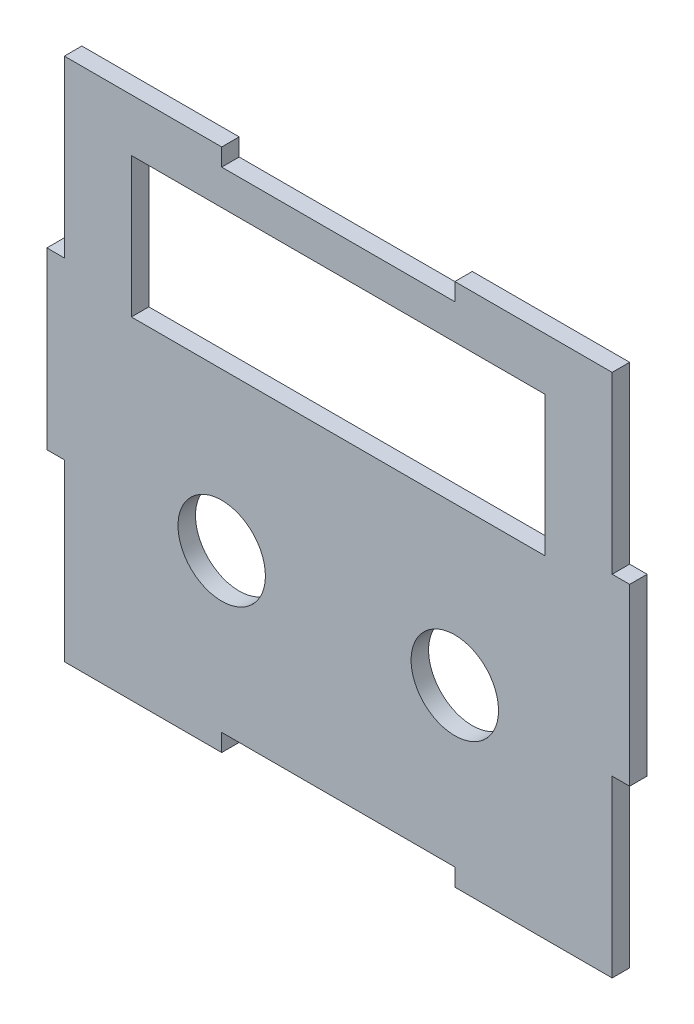
from build123d import *

# Parameters (mm, degrees)
ESQUISSE1_W             = 100
ESQUISSE1_H             = 90
ESQUISSE1_R             = 7.5
ESQUISSE1_W_2           = 71
ESQUISSE1_H_2           = 24
BOSS_EXTRU_1_DEPTH      = 3
ENL_V_MAT_EXTRU_1_REACH = 90.04
ESQUISSE2_W             = 40
ESQUISSE2_H             = 3
ESQUISSE2_W_2           = 3
ESQUISSE2_H_2           = 30


with BuildPart() as part:
    # Esquisse1 → Boss.-Extru.1 (new body)
    with BuildSketch(Plane.XY):
        with Locations((-10.038524431, -19.32304038)):
            Rectangle(ESQUISSE1_W, ESQUISSE1_H)
        with Locations((-30.038524431, -34.32304038)):
            Circle(ESQUISSE1_R, mode=Mode.SUBTRACT)
        with Locations((9.961475569, -34.32304038)):
            Circle(ESQUISSE1_R, mode=Mode.SUBTRACT)
        with Locations((-10.038524431, 4.660332542)):
            Rectangle(ESQUISSE1_W_2, ESQUISSE1_H_2, mode=Mode.SUBTRACT)
    extrude(amount=BOSS_EXTRU_1_DEPTH)

    # Esquisse2 → Enlèv. mat.-Extru.1 (cut, up to next)
    with BuildSketch(Plane.XY.offset(3), mode=Mode.PRIVATE) as enl_v_mat_extru_1_sk1:
        with Locations((-10.038524431, 24.17695962)):
            Rectangle(ESQUISSE2_W, ESQUISSE2_H)
    enl_v_mat_extru_1_tool1 = extrude(enl_v_mat_extru_1_sk1.sketch, amount=-ENL_V_MAT_EXTRU_1_REACH, mode=Mode.PRIVATE) & part.part
    # Esquisse2 → Enlèv. mat.-Extru.1 (cut, up to next)
    with BuildSketch(Plane.XY.offset(3), mode=Mode.PRIVATE) as enl_v_mat_extru_1_sk2:
        with Locations((-58.538524431, 10.67695962)):
            Rectangle(ESQUISSE2_W_2, ESQUISSE2_H_2)
    enl_v_mat_extru_1_tool2 = extrude(enl_v_mat_extru_1_sk2.sketch, amount=-ENL_V_MAT_EXTRU_1_REACH, mode=Mode.PRIVATE) & part.part
    # Esquisse2 → Enlèv. mat.-Extru.1 (cut, up to next)
    with BuildSketch(Plane.XY.offset(3), mode=Mode.PRIVATE) as enl_v_mat_extru_1_sk3:
        with Locations((-58.538524431, -49.32304038)):
            Rectangle(ESQUISSE2_W_2, ESQUISSE2_H_2)
    enl_v_mat_extru_1_tool3 = extrude(enl_v_mat_extru_1_sk3.sketch, amount=-ENL_V_MAT_EXTRU_1_REACH, mode=Mode.PRIVATE) & part.part
    # Esquisse2 → Enlèv. mat.-Extru.1 (cut, up to next)
    with BuildSketch(Plane.XY.offset(3), mode=Mode.PRIVATE) as enl_v_mat_extru_1_sk4:
        with Locations((-10.038524431, -62.82304038)):
            Rectangle(ESQUISSE2_W, ESQUISSE2_H)
    enl_v_mat_extru_1_tool4 = extrude(enl_v_mat_extru_1_sk4.sketch, amount=-ENL_V_MAT_EXTRU_1_REACH, mode=Mode.PRIVATE) & part.part
    # Esquisse2 → Enlèv. mat.-Extru.1 (cut, up to next)
    with BuildSketch(Plane.XY.offset(3), mode=Mode.PRIVATE) as enl_v_mat_extru_1_sk5:
        with Locations((38.461475569, -49.32304038)):
            Rectangle(ESQUISSE2_W_2, ESQUISSE2_H_2)
    enl_v_mat_extru_1_tool5 = extrude(enl_v_mat_extru_1_sk5.sketch, amount=-ENL_V_MAT_EXTRU_1_REACH, mode=Mode.PRIVATE) & part.part
    # Esquisse2 → Enlèv. mat.-Extru.1 (cut, up to next)
    with BuildSketch(Plane.XY.offset(3), mode=Mode.PRIVATE) as enl_v_mat_extru_1_sk6:
        with Locations((38.461475569, 10.67695962)):
            Rectangle(ESQUISSE2_W_2, ESQUISSE2_H_2)
    enl_v_mat_extru_1_tool6 = extrude(enl_v_mat_extru_1_sk6.sketch, amount=-ENL_V_MAT_EXTRU_1_REACH, mode=Mode.PRIVATE) & part.part
    add(enl_v_mat_extru_1_tool1.solids().sort_by_distance((-10.038524, 24.17696, 3))[0], mode=Mode.SUBTRACT)
    add(enl_v_mat_extru_1_tool2.solids().sort_by_distance((-58.538524, 10.67696, 3))[0], mode=Mode.SUBTRACT)
    add(enl_v_mat_extru_1_tool3.solids().sort_by_distance((-58.538524, -49.32304, 3))[0], mode=Mode.SUBTRACT)
    add(enl_v_mat_extru_1_tool4.solids().sort_by_distance((-10.038524, -62.82304, 3))[0], mode=Mode.SUBTRACT)
    add(enl_v_mat_extru_1_tool5.solids().sort_by_distance((38.461476, -49.32304, 3))[0], mode=Mode.SUBTRACT)
    add(enl_v_mat_extru_1_tool6.solids().sort_by_distance((38.461476, 10.67696, 3))[0], mode=Mode.SUBTRACT)


solid = part.part
